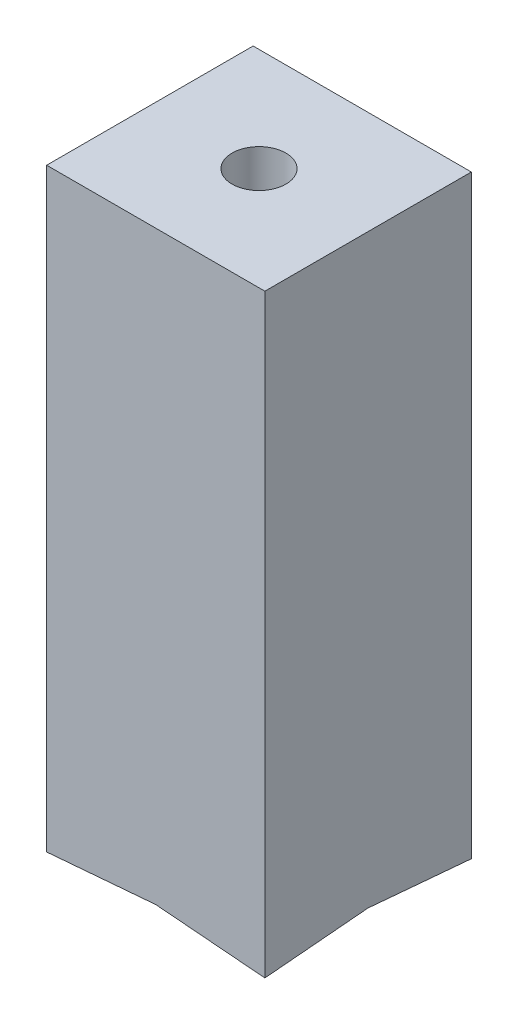
from build123d import *

# Parameters (mm, degrees)
SKETCH1_W             = 20.25
SKETCH1_H             = 19.16
BOSS_EXTRUDE1_DEPTH   = 55.2
CUT_EXTRUDE2_DEPTH    = 60.572467634
CUT_EXTRUDE3_DEPTH    = 60.301443701
M6_TAPPED_HOLE1_D     = 5
M6_TAPPED_HOLE1_DEPTH = 15
M6_TAPPED_HOLE1_TIP   = 1.502151548


with BuildPart() as part:
    # Sketch1 → Boss-Extrude1 (new body)
    with BuildSketch(Plane(origin=(0, 0, 0), x_dir=(1, 0, 0), z_dir=(0, 1, 0))):
        Rectangle(SKETCH1_W, SKETCH1_H)
    extrude(amount=-BOSS_EXTRUDE1_DEPTH)

    # Sketch5 → Cut-Extrude2 (cut, through all)
    with BuildSketch(Plane(origin=(10.125, 0, 0), x_dir=(0, 0, -1), z_dir=(1, 0, 0))):
        Polygon((-9.58, -55.2), (0, -54.361858603), (9.58, -55.2), align=None)
    extrude(amount=-CUT_EXTRUDE2_DEPTH, mode=Mode.SUBTRACT)

    # Sketch6 → Cut-Extrude3 (cut, through all)
    with BuildSketch(Plane.XY.offset(9.58)):
        Polygon((-10.125, -55.2), (0, -54.361858603), (10.125, -55.2), align=None)
    extrude(amount=-CUT_EXTRUDE3_DEPTH, mode=Mode.SUBTRACT)

    # M6 Tapped Hole1
    with Locations(Plane(origin=(0, 0, 0), x_dir=(1, 0, 0), z_dir=(0, 1, 0))):
        with Locations((0, 0)):
            Hole(M6_TAPPED_HOLE1_D / 2, depth=M6_TAPPED_HOLE1_DEPTH)
            with Locations((0, 0, -(M6_TAPPED_HOLE1_DEPTH + M6_TAPPED_HOLE1_TIP / 2))):  # 118° drill point
                Cone(0, M6_TAPPED_HOLE1_D / 2, M6_TAPPED_HOLE1_TIP, mode=Mode.SUBTRACT)


solid = part.part
